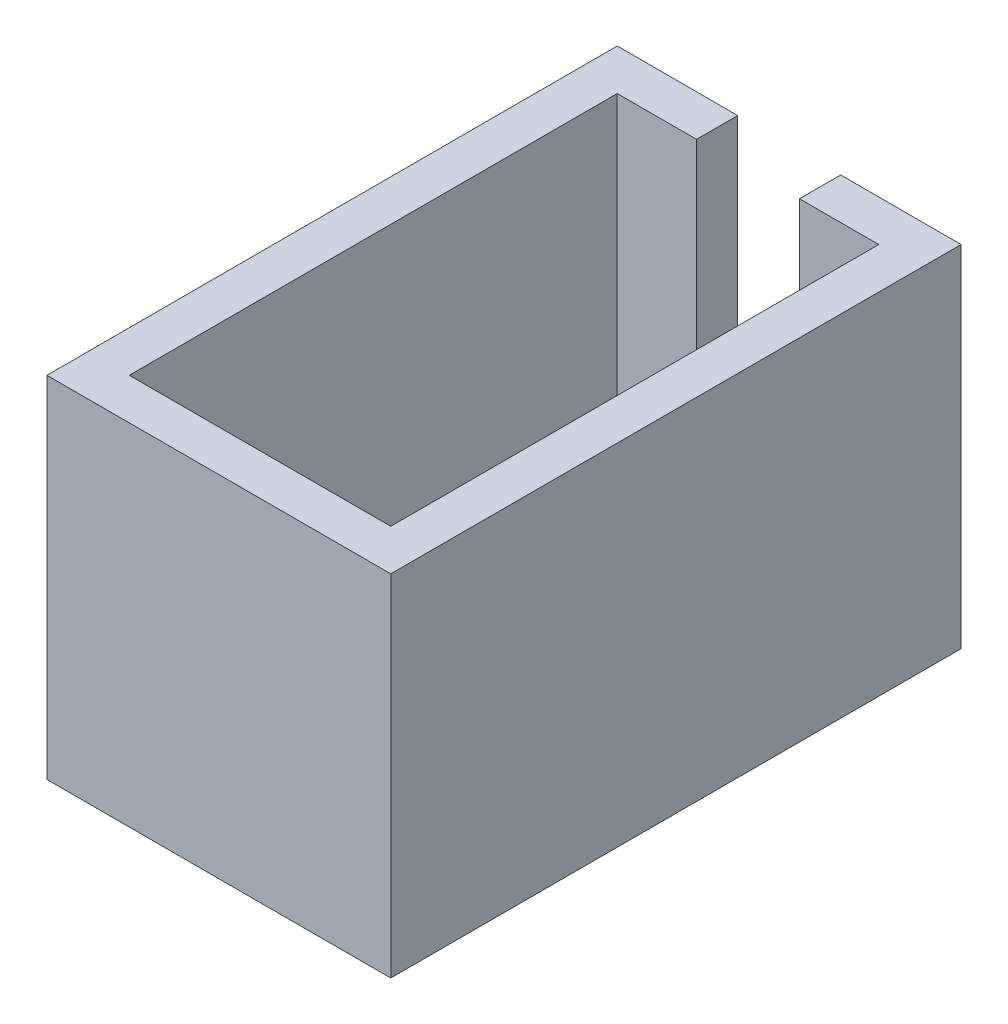
from build123d import *

# Parameters (mm, degrees)
SKETCH1_W           = 12.7
SKETCH1_H           = 23.7
BOSS_EXTRUDE1_DEPTH = 2
SKETCH2_W           = 12.7
SKETCH2_H           = 17
BOSS_EXTRUDE2_DEPTH = 2
SKETCH3_W           = 12.7
SKETCH3_H           = 17
BOSS_EXTRUDE3_DEPTH = 2
SKETCH4_W           = 27.7
SKETCH4_H           = 17
BOSS_EXTRUDE4_DEPTH = 2
SKETCH5_W           = 27.7
SKETCH5_H           = 17
BOSS_EXTRUDE5_DEPTH = 2
CUT_EXTRUDE2_REACH  = 36.141
SKETCH7_W           = 5
SKETCH7_H           = 12.5


with BuildPart() as part:
    # Sketch1 → Boss-Extrude1 (new body)
    with BuildSketch(Plane(origin=(0, 0, 0), x_dir=(1, 0, 0), z_dir=(0, 1, 0))):
        with Locations((6.35, 11.85)):
            Rectangle(SKETCH1_W, SKETCH1_H)
    extrude(amount=BOSS_EXTRUDE1_DEPTH)

    # Sketch2 → Boss-Extrude2 (add)
    with BuildSketch(Plane.XY):
        with Locations((6.35, 8.5)):
            Rectangle(SKETCH2_W, SKETCH2_H)
    extrude(amount=BOSS_EXTRUDE2_DEPTH)

    # Sketch3 → Boss-Extrude3 (add)
    with BuildSketch(Plane(origin=(0, 0, -23.7), x_dir=(-1, 0, 0), z_dir=(0, 0, -1))):
        with Locations((-6.35, 8.5)):
            Rectangle(SKETCH3_W, SKETCH3_H)
    extrude(amount=BOSS_EXTRUDE3_DEPTH)

    # Sketch4 → Boss-Extrude4 (add)
    with BuildSketch(Plane(origin=(12.7, 0, 0), x_dir=(0, 0, -1), z_dir=(1, 0, 0))):
        with Locations((11.85, 8.5)):
            Rectangle(SKETCH4_W, SKETCH4_H)
    extrude(amount=BOSS_EXTRUDE4_DEPTH)

    # Sketch5 → Boss-Extrude5 (add)
    with BuildSketch(Plane.ZY):
        with Locations((-11.85, 8.5)):
            Rectangle(SKETCH5_W, SKETCH5_H)
    extrude(amount=BOSS_EXTRUDE5_DEPTH)

    # Sketch7 → Cut-Extrude2 (cut, up to next)
    with BuildSketch(Plane.XY.offset(-23.7), mode=Mode.PRIVATE) as cut_extrude2_sk1:
        with Locations((6.35, 10.75)):
            Rectangle(SKETCH7_W, SKETCH7_H)
    cut_extrude2_tool1 = extrude(cut_extrude2_sk1.sketch, amount=-CUT_EXTRUDE2_REACH, mode=Mode.PRIVATE) & part.part
    add(cut_extrude2_tool1.solids().sort_by_distance((6.35, 10.75, -23.7))[0], mode=Mode.SUBTRACT)


solid = part.part
